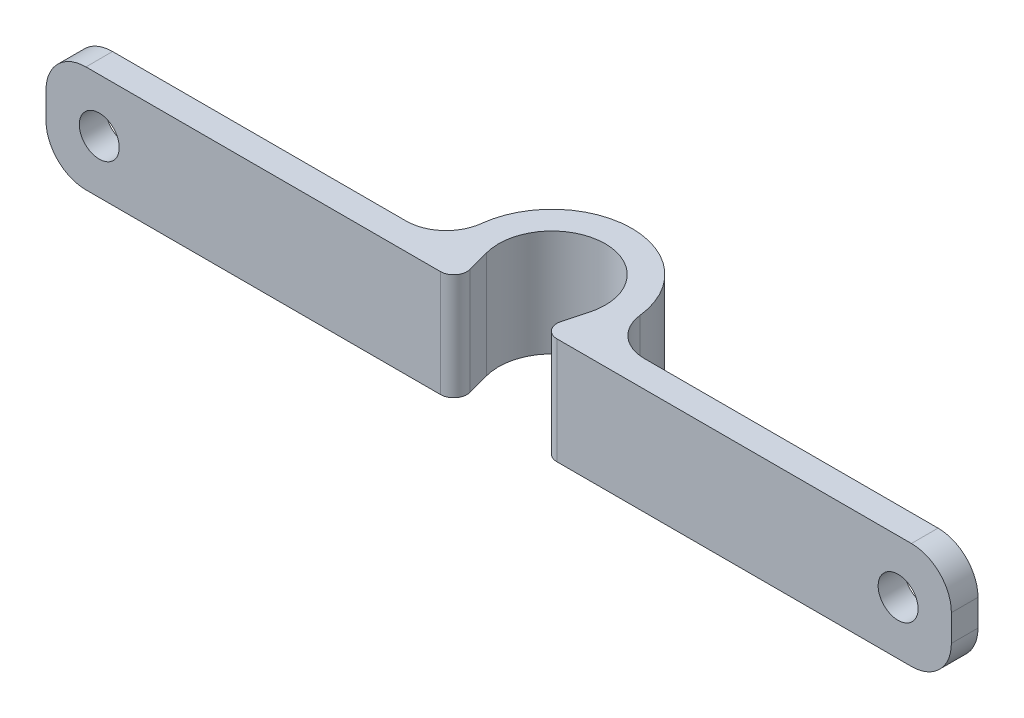
from build123d import *

# Parameters (mm, degrees)
EXTRU_MINCE1_DEPTH      = 4
CONG_1_R                = 1
CONG_2_R                = 3
ESQUISSE2_R             = 1.5
ENL_V_MAT_EXTRU_1_DEPTH = 36.156791793


with BuildPart() as part:
    # Esquisse1 → Extru.-Mince1 (new, symmetric)
    with BuildSketch(Plane(origin=(0, 0, 0), x_dir=(1, 0, 0), z_dir=(0, 1, 0))):
        with BuildLine():
            Line((-34, 0), (-3.069307952, 0))
            Line((-3.069307952, 0), (-3.863703305, 2.96472382))
            ThreePointArc((-3.863703305, 2.96472382), (0, 8), (3.863703305, 2.96472382))
            Line((3.863703305, 2.96472382), (3.069307952, 0))
            Line((3.069307952, 0), (34, 0))
            Line((34, 0), (34, 2))
            Line((34, 2), (5.675758698, 2))
            Line((5.675758698, 2), (5.795554958, 2.447085729))
            ThreePointArc((5.795554958, 2.447085729), (0, 10), (-5.795554958, 2.447085729))
            Line((-5.795554958, 2.447085729), (-5.675758698, 2))
            Line((-5.675758698, 2), (-34, 2))
            Line((-34, 2), (-34, 0))
        make_face()
    extrude(amount=EXTRU_MINCE1_DEPTH, both=True)

    # Congé1
    cong_1_edges = [part.edges().sort_by_distance(p)[0] for p in [
        (3.069307952, 0, 0),
        (-3.069307952, 0, 0),
    ]]
    fillet(cong_1_edges, radius=CONG_1_R)

    # Congé2
    cong_2_edges = [part.edges().sort_by_distance(p)[0] for p in [
        (34, -4, -1),
        (34, 4, -1),
        (5.675758698, 0, -2),
        (-34, -4, -1),
        (-34, 4, -1),
        (-5.675758698, 0, -2),
    ]]
    fillet(cong_2_edges, radius=CONG_2_R)

    # Esquisse2 → Enlèv. mat.-Extru.1 (cut, through all)
    with BuildSketch(Plane(origin=(0, 0, -2), x_dir=(-1, 0, 0), z_dir=(0, 0, -1))):
        with Locations((-30, 0)):
            Circle(ESQUISSE2_R)
        with Locations(Location((30, 0, 0), (0, 0, 180))):
            Circle(ESQUISSE2_R)
    extrude(amount=-ENL_V_MAT_EXTRU_1_DEPTH, mode=Mode.SUBTRACT)


solid = part.part
